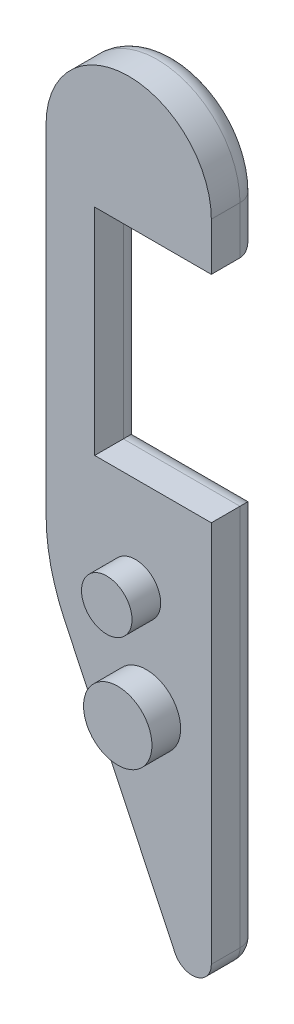
from build123d import *

# Parameters (mm, degrees)
EXTRUDE_1_DEPTH = 5
SKETCH_3_R      = 2.640227158
SKETCH_3_R_2    = 3.578323713
EXTRUDE_2_DEPTH = 3
FILLET_3_R      = 2


with BuildPart() as part:
    # 草圖1 → 填料-伸長1 (new body)
    with BuildSketch(Plane.XY):
        with BuildLine():
            Line((0, 0), (-12.2, 0))
            Line((-12.2, 0), (-12.2, -22.5))
            Line((-12.2, -22.5), (0, -22.5))
            Line((0, -22.5), (0, -62.5))
            ThreePointArc((0, -62.5), (-1.561204321, -64.451270958), (-3.807458352, -63.356209266))
            Line((-3.807458352, -63.356209266), (-15.358968834, -38.970962655))
            ThreePointArc((-15.358968834, -38.970962655), (-16.797094897, -34.796826792), (-17.284385317, -30.408869998))
            Line((-17.284385317, -30.408869998), (-17.284385317, 5))
            ThreePointArc((-17.284385317, 5), (-8.642192658, 13.642192658), (0, 5))
            Line((0, 5), (0, 0))
        make_face()
    extrude(amount=EXTRUDE_1_DEPTH)

    # 草圖3 → 填料-伸長2 (add)
    with BuildSketch(Plane.XY.offset(5)):
        with Locations(Location((-7.938901353, -32.425782639, 0), (0, 0, 180))):
            Circle(SKETCH_3_R)
        with Locations(Location((-6.788376637, -42.772023111, 0), (0, 0, 180))):
            Circle(SKETCH_3_R_2)
    extrude(amount=EXTRUDE_2_DEPTH)

    # 圓角3
    fillet_3_edges = [part.edges().sort_by_distance(p)[0] for p in [
        (-6.1, -22.5, 0),
        (0, -42.5, 0),
        (-1.561204321, -64.451270958, 0),
        (-9.583213593, -51.163585961, 0),
        (-16.797094897, -34.796826792, 0),
        (-17.284385317, -12.704434999, 0),
        (-8.642192658, 13.642192658, 0),
        (0, 2.5, 0),
        (-6.1, 0, 0),
        (-12.2, -11.25, 0),
    ]]
    fillet(fillet_3_edges, radius=FILLET_3_R)


solid = part.part
